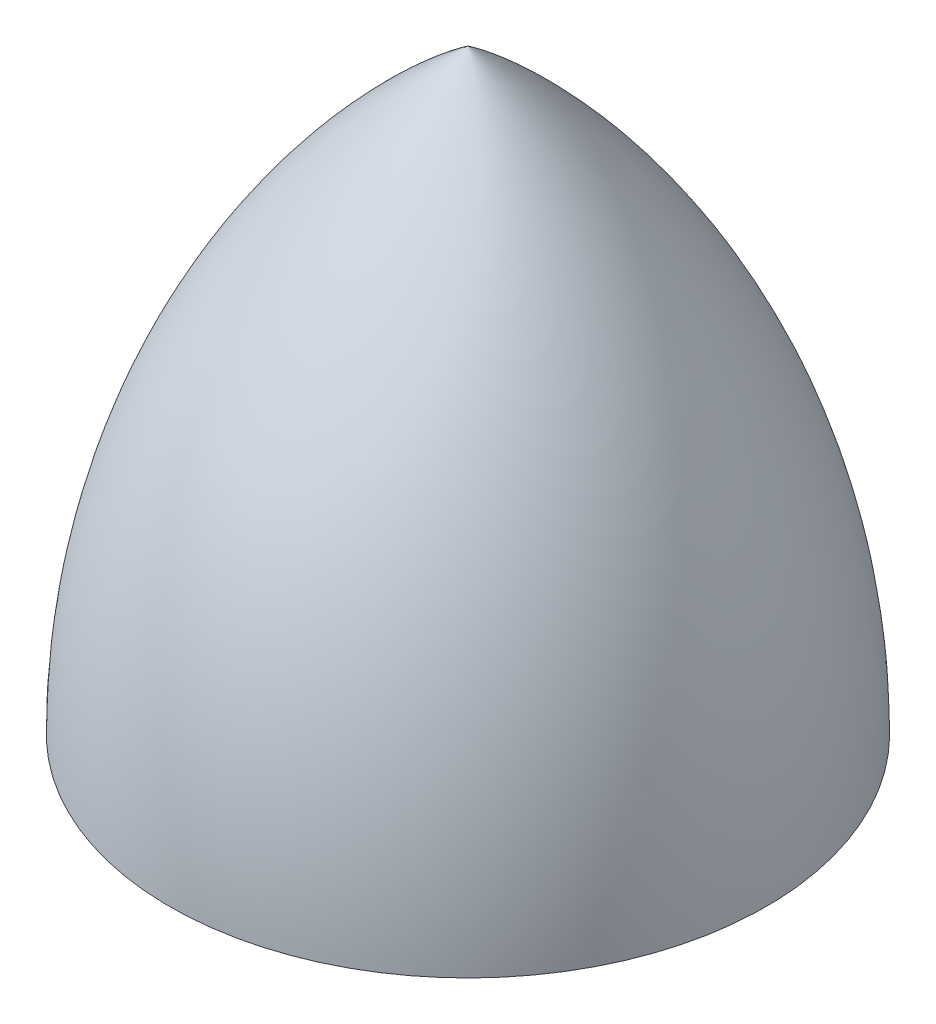
from build123d import *


with BuildPart() as part:
    # Sketch1 → Revolve1 (revolve)
    with BuildSketch(Plane.XY):
        with BuildLine():
            Line((0, 30), (0, 0))
            Line((0, 0), (15, 0))
            ThreePointArc((15, 0), (11.041019662, 16.770509831), (0, 30))
        make_face()
    revolve(axis=Axis((0, 30, 0), (0, -1, 0)))


solid = part.part
